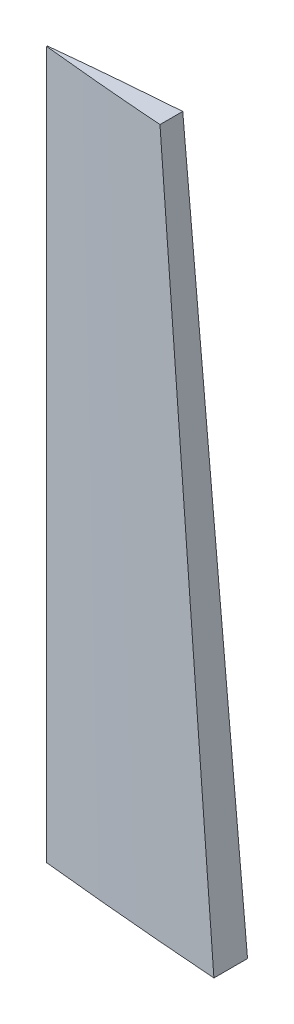
from build123d import *


with BuildPart() as part:
    # Sketch1 → Loft1 section 0
    with BuildSketch(Plane(origin=(0, 22, 0), x_dir=(1, 0, 0), z_dir=(0, 1, 0))):
        with BuildLine():
            Line((-110.7624, 4.105065425), (-110.7624, -4.105065425))
            add(Edge.make_bspline(
                [(-110.7624, -4.105065425), (-110.930180204, -4.093226768), (-113.421586825, -3.917431838), (-118.098594347, -3.555230855), (-124.633705995, -3.033487935), (-130.689149654, -2.521189341), (-136.19888791, -2.034192057), (-141.102475085, -1.582638673), (-145.34620445, -1.177644216), (-148.883583494, -0.82947508), (-151.67587131, -0.547568394), (-153.692486617, -0.339912657), (-154.911359223, -0.212763273), (-155.45556693, -0.1555553), (-155.592, -0.14121324)],
                knots=[0, 0, 0, 0, 0.011211572, 0.166483201, 0.31268616, 0.448210553, 0.571562716, 0.681381362, 0.776452467, 0.855722863, 0.918312437, 0.963524724, 0.990855635, 1, 1, 1, 1], degree=3))
            Line((-155.592, -0.14121324), (-155.592, 0.14121324))
            add(Edge.make_bspline(
                [(-110.7624, 4.105065425), (-110.930180204, 4.093226768), (-113.421586825, 3.917431838), (-118.098594347, 3.555230855), (-124.633705995, 3.033487935), (-130.689149654, 2.521189341), (-136.19888791, 2.034192057), (-141.102475085, 1.582638673), (-145.34620445, 1.177644216), (-148.883583494, 0.82947508), (-151.67587131, 0.547568394), (-153.692486617, 0.339912657), (-154.911359223, 0.212763273), (-155.45556693, 0.1555553), (-155.592, 0.14121324)],
                knots=[0, 0, 0, 0, 0.011211572, 0.166483201, 0.31268616, 0.448210553, 0.571562716, 0.681381362, 0.776452467, 0.855722863, 0.918312437, 0.963524724, 0.990855635, 1, 1, 1, 1], degree=3))
        make_face()
    # Sketch2 → Loft1 section 1
    with BuildSketch(Plane(origin=(0, 194.49, 0), x_dir=(1, 0, 0), z_dir=(0, 1, 0))):
        with BuildLine():
            Line((-125.25156, 2.778286918), (-125.25156, -2.778286918))
            add(Edge.make_bspline(
                [(-125.25156, -2.778286918), (-125.365112769, -2.770274576), (-127.051283806, -2.651297483), (-130.216658158, -2.406161742), (-134.639587715, -2.053048849), (-138.737880473, -1.706327826), (-142.466842653, -1.376730599), (-145.785564937, -1.071121618), (-148.657698888, -0.797023477), (-151.051778617, -0.561384418), (-152.941584481, -0.37059144), (-154.306419227, -0.230051117), (-155.131345864, -0.143997076), (-155.499662808, -0.105279017), (-155.592, -0.095572386)],
                knots=[0, 0, 0, 0, 0.011211572, 0.166483201, 0.31268616, 0.448210553, 0.571562716, 0.681381362, 0.776452467, 0.855722863, 0.918312437, 0.963524724, 0.990855635, 1, 1, 1, 1], degree=3))
            Line((-155.592, -0.095572386), (-155.592, 0.095572386))
            add(Edge.make_bspline(
                [(-125.25156, 2.778286918), (-125.365112769, 2.770274576), (-127.051283806, 2.651297483), (-130.216658158, 2.406161742), (-134.639587715, 2.053048849), (-138.737880473, 1.706327826), (-142.466842653, 1.376730599), (-145.785564937, 1.071121618), (-148.657698888, 0.797023477), (-151.051778617, 0.561384418), (-152.941584481, 0.37059144), (-154.306419227, 0.230051117), (-155.131345864, 0.143997076), (-155.499662808, 0.105279017), (-155.592, 0.095572386)],
                knots=[0, 0, 0, 0, 0.011211572, 0.166483201, 0.31268616, 0.448210553, 0.571562716, 0.681381362, 0.776452467, 0.855722863, 0.918312437, 0.963524724, 0.990855635, 1, 1, 1, 1], degree=3))
        make_face()
    loft()


solid = part.part
